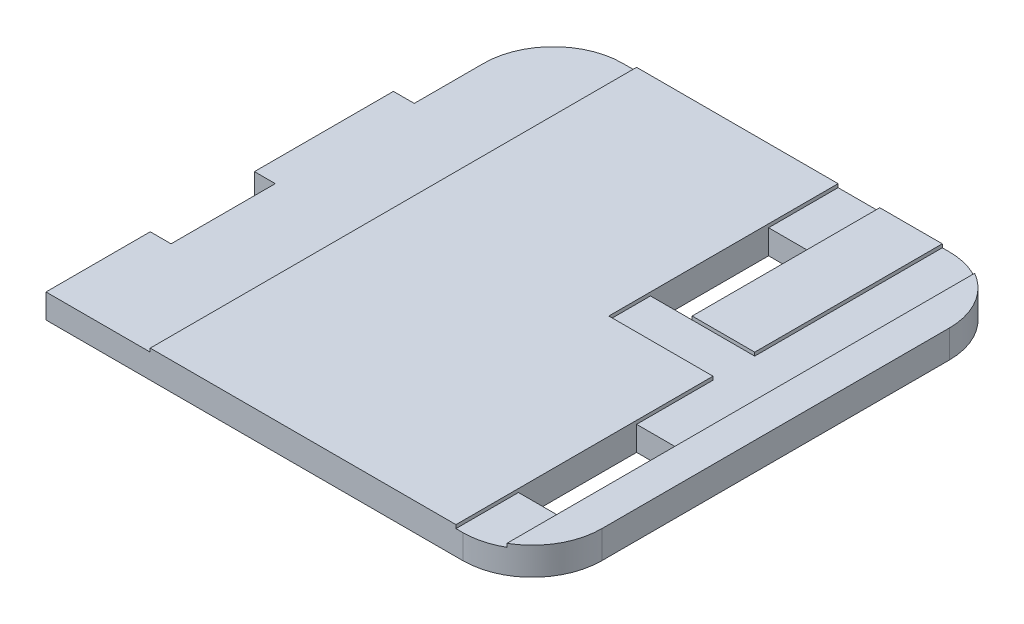
from build123d import *

# Parameters (mm, degrees)
SKETCH1_W           = 0.6
SKETCH1_H           = 1.7
BOSS_EXTRUDE1_DEPTH = 0.4
FILLET1_R           = 1
SKETCH3_W           = 0.6
SKETCH3_H           = 0.9
SKETCH3_H_2         = 1
CUT_EXTRUDE2_DEPTH  = 0.05


with BuildPart() as part:
    # Sketch1 → Boss-Extrude1 (new body)
    with BuildSketch(Plane(origin=(0, 0, 0), x_dir=(1, 0, 0), z_dir=(0, 1, 0))):
        Polygon((0, 0), (7, 0), (7, 7), (0.3, 7), (0.3, 5), (0, 5), (0, 3), (0.3, 3), (0.3, 1.5), (0, 1.5), align=None)
        with Locations((4.7, 5.15)):
            Rectangle(SKETCH1_W, SKETCH1_H, mode=Mode.SUBTRACT)
        with Locations((6.2, 1.75)):
            Rectangle(SKETCH1_W, SKETCH1_H, mode=Mode.SUBTRACT)
    extrude(amount=BOSS_EXTRUDE1_DEPTH)

    # Fillet1
    fillet1_edges = [part.edges().sort_by_distance(p)[0] for p in [
        (0.3, 0.2, -7),
        (7, 0.2, -7),
        (7, 0.2, 0),
    ]]
    fillet(fillet1_edges, radius=FILLET1_R)

    # Sketch3 → Cut-Extrude2 (cut)
    with BuildSketch(Plane(origin=(0, 0.4, 0), x_dir=(1, 0, 0), z_dir=(0, 1, 0))):
        with BuildLine():
            Line((1.5, 0), (1.5, 7))
            Line((1.5, 7), (1.3, 7))
            ThreePointArc((1.3, 7), (0.592893219, 6.707106781), (0.3, 6))
            Line((0.3, 6), (0.3, 5))
            Line((0.3, 5), (0, 5))
            Line((0, 5), (0, 3))
            Line((0, 3), (0.3, 3))
            Line((0.3, 3), (0.3, 1.5))
            Line((0.3, 1.5), (0, 1.5))
            Line((0, 1.5), (0, 0))
            Line((0, 0), (1.5, 0))
        make_face()
        with Locations((6.2, 0.45)):
            Rectangle(SKETCH3_W, SKETCH3_H)
        Polygon((4.4, 4.3), (5, 4.3), (5.9, 4.3), (5.9, 7), (5.9, 7.268876882), (6.5, 7.268876882), (6.5, 7), (6.5, 4.3), (6.5, 3.7), (6.5, 2.6), (5.9, 2.6), (5.9, 3.7), (4.4, 3.7), align=None)
        with Locations((4.7, 6.5)):
            Rectangle(SKETCH3_W, SKETCH3_H_2)
    extrude(amount=-CUT_EXTRUDE2_DEPTH, mode=Mode.SUBTRACT)


solid = part.part
